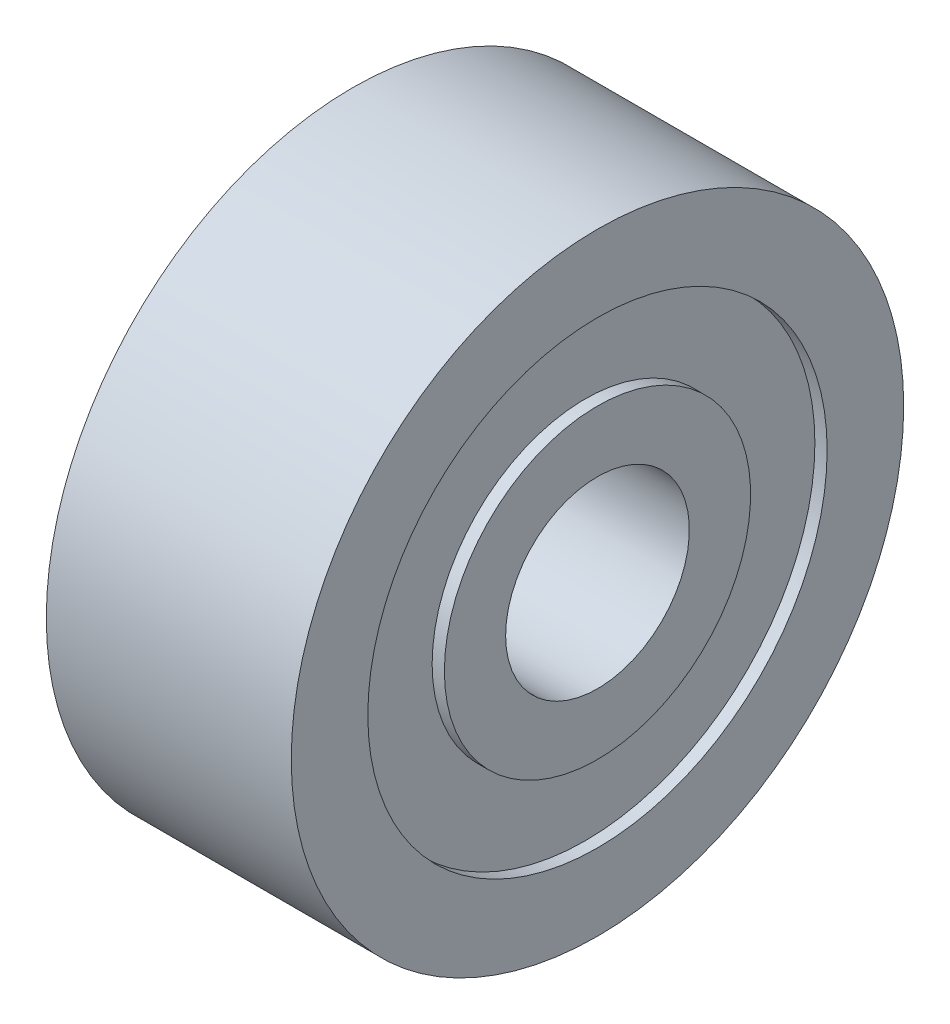
from build123d import *


with BuildPart() as part:
    # Esquisse1 → Révolution1 (revolve)
    with BuildSketch(Plane.XY, mode=Mode.PRIVATE) as r_volution1_sk:
        Polygon((-2, 2.5), (-1.8, 2.5), (-1.8, 3.75), (-2, 3.75), (-2, 5), (2, 5), (2, 3.75), (1.8, 3.75), (1.8, 2.5), (2, 2.5), (2, 1.5), (-2, 1.5), align=None)
    revolve(r_volution1_sk.sketch.rotate(Axis((-2, 0, 0), (1, 0, 0)), 90), axis=Axis((-2, 0, 0), (1, 0, 0)))


solid = part.part
